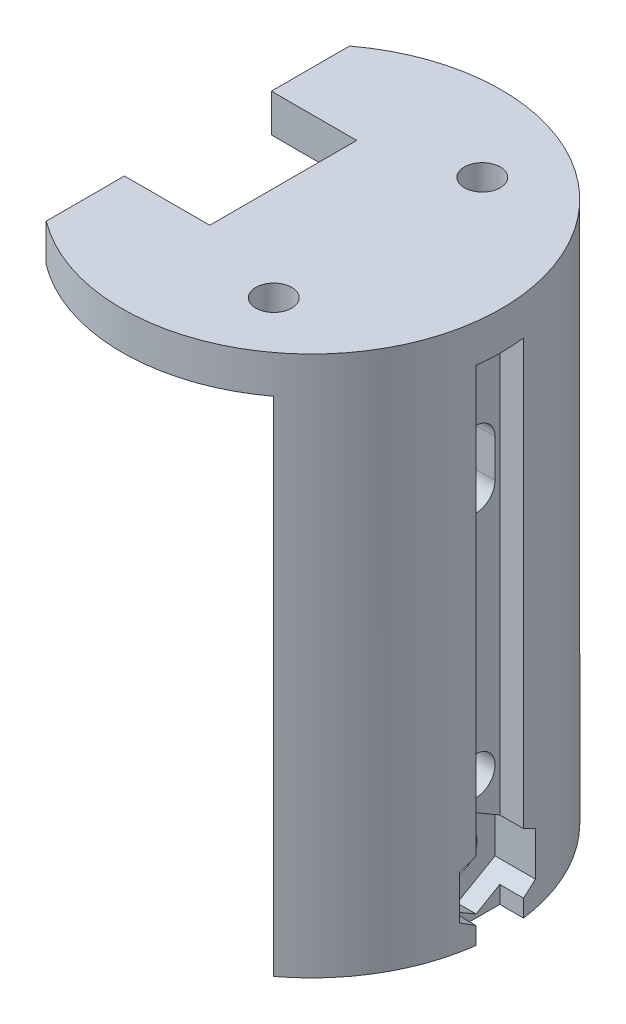
from build123d import *

# Parameters (mm, degrees)
PLATE_DEPTH             = 5.08
BOLTHOLES_REACH         = 38.278
SKETCH15_R              = 2.413
UPRIGHT_START           = 67.31
UPRIGHT_DEPTH           = 67.31
UPRIGHT_BOLTHOLES_REACH = 80.133
SKETCH17_R              = 2.54
SKETCH17_R_2            = 2.667
NUT_HOLE_START          = -2.54
NUT_HOLE_DEPTH          = 5.715


with BuildPart() as part:
    # Sketch2 → plate (new body)
    with BuildSketch(Plane(origin=(0, 0, 0), x_dir=(1, 0, 0), z_dir=(0, 1, 0))):
        with BuildLine():
            Line((-15.24, -20.32), (-15.24, -9.8425))
            Line((-15.24, -9.8425), (-3.81, -9.8425))
            Line((-3.81, -9.8425), (-3.81, 9.8425))
            Line((-3.81, 9.8425), (-15.24, 9.8425))
            Line((-15.24, 9.8425), (-15.24, 20.32))
            ThreePointArc((-15.24, 20.32), (25.4, 0), (-15.24, -20.32))
        make_face()
    extrude(amount=PLATE_DEPTH)

    # Sketch15 → boltholes (cut, up to next)
    with BuildSketch(Plane.XZ, mode=Mode.PRIVATE) as boltholes_sk1:
        with Locations(Location((8.89, 13.97, 0), (0, 0, 270))):
            Circle(SKETCH15_R)
    boltholes_tool1 = extrude(boltholes_sk1.sketch, amount=-BOLTHOLES_REACH, mode=Mode.PRIVATE) & part.part
    # Sketch15 → boltholes (cut, up to next)
    with BuildSketch(Plane.XZ, mode=Mode.PRIVATE) as boltholes_sk2:
        with Locations(Location((8.89, -13.97, 0), (0, 0, 270))):
            Circle(SKETCH15_R)
    boltholes_tool2 = extrude(boltholes_sk2.sketch, amount=-BOLTHOLES_REACH, mode=Mode.PRIVATE) & part.part
    add(boltholes_tool1.solids().sort_by_distance((8.89, 0, 13.97))[0], mode=Mode.SUBTRACT)
    add(boltholes_tool2.solids().sort_by_distance((8.89, 0, -13.97))[0], mode=Mode.SUBTRACT)

    # Sketch16 → upright (add)
    with BuildSketch(Plane.XZ.offset(UPRIGHT_START)):
        with BuildLine():
            Line((15.24, 20.32), (15.24, -20.32))
            ThreePointArc((15.24, -20.32), (21.962512448, -12.759625659), (25.200781238, -3.175))
            Line((25.200781238, -3.175), (22.025781238, -3.175))
            Line((22.025781238, -3.175), (22.025781238, 3.175))
            Line((22.025781238, 3.175), (25.200781238, 3.175))
            ThreePointArc((25.200781238, 3.175), (21.962512448, 12.759625659), (15.24, 20.32))
        make_face()
    extrude(amount=-UPRIGHT_DEPTH)

    # Sketch17 → upright_boltholes (cut, up to next)
    with BuildSketch(Plane.ZY.offset(-15.24), mode=Mode.PRIVATE) as upright_boltholes_sk1:
        with Locations((0, -50.8)):
            Circle(SKETCH17_R)
    upright_boltholes_tool1 = extrude(upright_boltholes_sk1.sketch, amount=-UPRIGHT_BOLTHOLES_REACH, mode=Mode.PRIVATE) & part.part
    # Sketch17 → upright_boltholes (cut, up to next)
    with BuildSketch(Plane.ZY.offset(-15.24), mode=Mode.PRIVATE) as upright_boltholes_sk2:
        with Locations((0, -60.96)):
            Circle(SKETCH17_R_2)
    upright_boltholes_tool2 = extrude(upright_boltholes_sk2.sketch, amount=-UPRIGHT_BOLTHOLES_REACH, mode=Mode.PRIVATE) & part.part
    # Sketch17 → upright_boltholes (cut, up to next)
    with BuildSketch(Plane.ZY.offset(-15.24), mode=Mode.PRIVATE) as upright_boltholes_sk3:
        with BuildLine():
            Line((2.54, -12.7), (2.54, -17.78))
            ThreePointArc((2.54, -17.78), (0, -20.32), (-2.54, -17.78))
            Line((-2.54, -17.78), (-2.54, -12.7))
            ThreePointArc((-2.54, -12.7), (0, -10.16), (2.54, -12.7))
        make_face()
    upright_boltholes_tool3 = extrude(upright_boltholes_sk3.sketch, amount=-UPRIGHT_BOLTHOLES_REACH, mode=Mode.PRIVATE) & part.part
    add(upright_boltholes_tool1.solids().sort_by_distance((15.24, -50.8, 0))[0], mode=Mode.SUBTRACT)
    add(upright_boltholes_tool2.solids().sort_by_distance((15.24, -60.96, 0))[0], mode=Mode.SUBTRACT)
    add(upright_boltholes_tool3.solids().sort_by_distance((15.24, -15.24, 0))[0], mode=Mode.SUBTRACT)

    # Sketch18 → nut_hole (cut)
    with BuildSketch(Plane(origin=(22.025781238, 0, 0), x_dir=(0, 0, -1), z_dir=(1, 0, 0)).offset(NUT_HOLE_START)):
        Polygon((0, -66.825878735), (5.08, -63.892939367), (5.08, -58.027060633), (0, -55.094121265), (-5.08, -58.027060633), (-5.08, -63.892939367), align=None)
    extrude(amount=NUT_HOLE_DEPTH, mode=Mode.SUBTRACT)


solid = part.part
